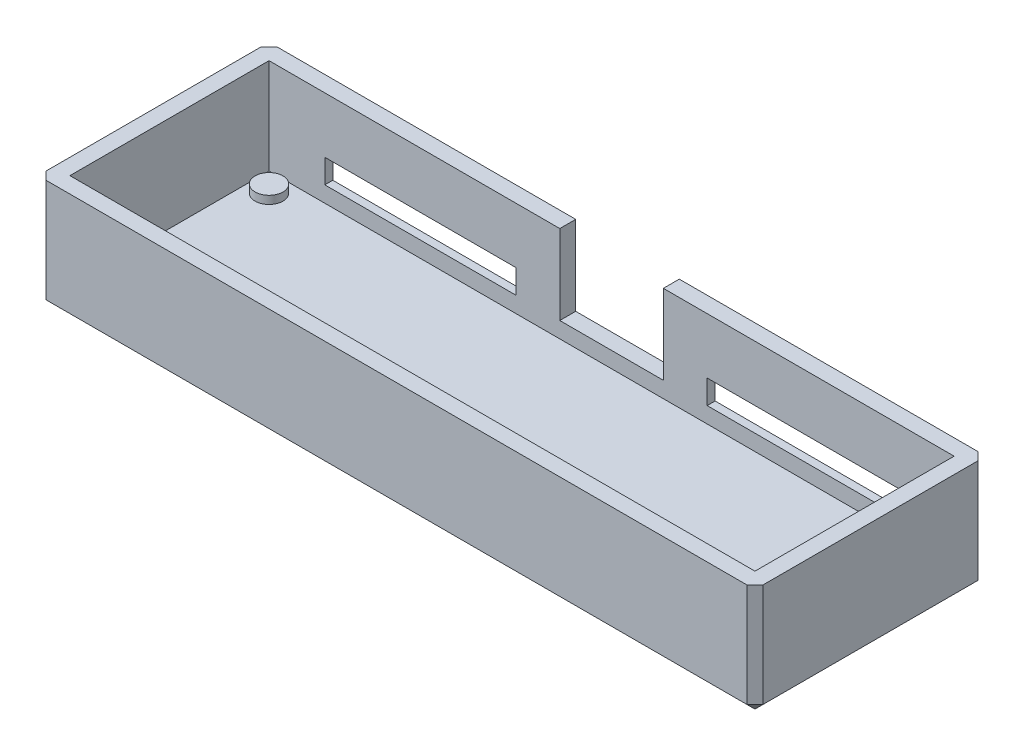
from build123d import *

# Parameters (mm, degrees)
SKETCH1_W                = 90
SKETCH1_H                = 29
SKETCH1_W_2              = 86
SKETCH1_H_2              = 25
BOSS_EXTRUDE1_DEPTH      = 12
SKETCH1_2_W              = 90
SKETCH1_2_H              = 29
BOSS_EXTRUDE2_DEPTH      = 2
SKETCH2_R                = 1
BOSS_EXTRUDE3_DEPTH      = 2.65
SKETCH3_R                = 1.75
BOSS_EXTRUDE4_DEPTH      = 1
CHAMFER1_SIZE            = 1
CUT_EXTRUDE1_REACH       = 55.833
SKETCH4_W                = 13
SKETCH4_H                = 10
CUT_EXTRUDE2_REACH       = 56.863
SKETCH5_W                = 24
SKETCH5_H                = 3
CHAMFER2_SIZE            = 1
CHAMFER2_OF_MIRROR2_SIZE = 1


with BuildPart() as part:
    # Sketch1 → Boss-Extrude1 (new body)
    with BuildSketch(Plane(origin=(0, 0, 0), x_dir=(1, 0, 0), z_dir=(0, 1, 0))):
        Rectangle(SKETCH1_W, SKETCH1_H)
        Rectangle(SKETCH1_W_2, SKETCH1_H_2, mode=Mode.SUBTRACT)
    extrude(amount=BOSS_EXTRUDE1_DEPTH)

    # Sketch1<2> → Boss-Extrude2 (add)
    with BuildSketch(Plane(origin=(0, 0, 0), x_dir=(1, 0, 0), z_dir=(0, 1, 0))):
        Rectangle(SKETCH1_2_W, SKETCH1_2_H)
    extrude(amount=-BOSS_EXTRUDE2_DEPTH)

    # Sketch2 → Boss-Extrude3 (add)
    with BuildSketch(Plane(origin=(0, 0, 0), x_dir=(1, 0, 0), z_dir=(0, 1, 0))):
        with Locations((40.6, -10.1)):
            Circle(SKETCH2_R)
        with Locations((-40.6, -10.1)):
            Circle(SKETCH2_R)
    extrude(amount=BOSS_EXTRUDE3_DEPTH)

    # Sketch3 → Boss-Extrude4 (add)
    with BuildSketch(Plane(origin=(0, 0, 0), x_dir=(1, 0, 0), z_dir=(0, 1, 0))):
        with Locations((40.6, -10.1)):
            Circle(SKETCH3_R)
        with Locations((-40.6, -10.1)):
            Circle(SKETCH3_R)
    boss_extrude4 = extrude(amount=BOSS_EXTRUDE4_DEPTH)

    # Mirror1: Boss-Extrude4 across plane
    add(boss_extrude4.mirror(Plane.XY))

    # Chamfer1
    chamfer1_edges = [part.edges().sort_by_distance(p)[0] for p in [
        (45, 5, -14.5),
        (45, 5, 14.5),
        (45, -2, 0),
        (0, -2, 14.5),
        (-45, 5, 14.5),
        (-45, -2, 0),
        (0, -2, -14.5),
        (-45, 5, -14.5),
    ]]
    chamfer(chamfer1_edges, length=CHAMFER1_SIZE)

    # Sketch4 → Cut-Extrude1 (cut, up to next)
    with BuildSketch(Plane(origin=(0, 0, -12.5), x_dir=(-1, 0, 0), z_dir=(0, 0, -1)), mode=Mode.PRIVATE) as cut_extrude1_sk1:
        with Locations((0, 7)):
            Rectangle(SKETCH4_W, SKETCH4_H)
    cut_extrude1_tool1 = extrude(cut_extrude1_sk1.sketch, amount=CUT_EXTRUDE1_REACH, mode=Mode.PRIVATE) & part.part
    add(cut_extrude1_tool1.solids().sort_by_distance((0, 7, -12.5))[0], mode=Mode.SUBTRACT)

    # Sketch5 → Cut-Extrude2 (cut, up to next)
    with BuildSketch(Plane(origin=(0, 0, -14.5), x_dir=(-1, 0, 0), z_dir=(0, 0, -1)), mode=Mode.PRIVATE) as cut_extrude2_sk1:
        with Locations((-24, 3.5)):
            Rectangle(SKETCH5_W, SKETCH5_H)
    cut_extrude2_tool1 = extrude(cut_extrude2_sk1.sketch, amount=-CUT_EXTRUDE2_REACH, mode=Mode.PRIVATE) & part.part
    cut_extrude2 = cut_extrude2_tool1.solids().sort_by_distance((24, 3.5, -14.5))[0]
    add(cut_extrude2, mode=Mode.SUBTRACT)

    # Chamfer2
    chamfer2_edges = [part.edges().sort_by_distance(p)[0] for p in [
        (36, 3.5, -14.5),
        (24, 2, -14.5),
        (12, 3.5, -14.5),
        (24, 5, -14.5),
    ]]
    chamfer(chamfer2_edges, length=CHAMFER2_SIZE)

    # Mirror2: Cut-Extrude2 across plane
    add(cut_extrude2.mirror(Plane(origin=(0, 0, 0), x_dir=(0, 0, 1), z_dir=(1, 0, 0))), mode=Mode.SUBTRACT)

    # Chamfer2 of Mirror2
    chamfer2_of_mirror2_edges = [part.edges().sort_by_distance(p)[0] for p in [
        (-36, 3.5, -14.5),
        (-24, 2, -14.5),
        (-12, 3.5, -14.5),
        (-24, 5, -14.5),
    ]]
    chamfer(chamfer2_of_mirror2_edges, length=CHAMFER2_OF_MIRROR2_SIZE)


solid = part.part
